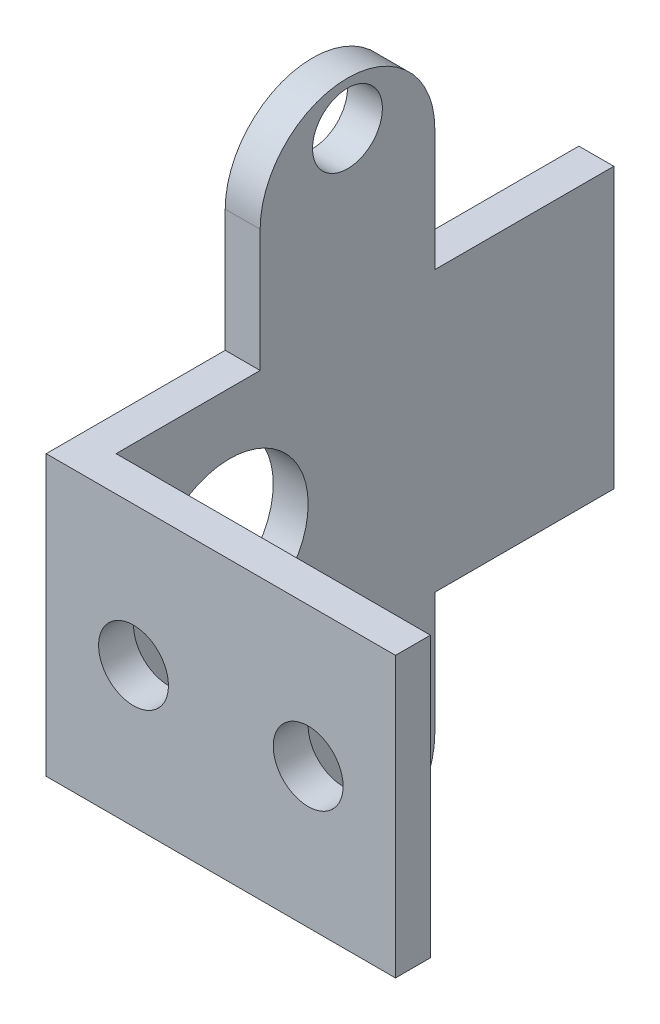
from build123d import *

# Parameters (mm, degrees)
BOSS_EXTRUDE1_DEPTH = 16
SKETCH4_R           = 2
CUT_EXTRUDE1_DEPTH  = 16
SKETCH6_W           = 2
SKETCH6_H           = 10
BOSS_EXTRUDE2_DEPTH = 12
CUT_EXTRUDE2_DEPTH  = 12
SKETCH8_R           = 2
CUT_EXTRUDE3_DEPTH  = 12
SKETCH9_R           = 4.5
CUT_EXTRUDE4_DEPTH  = 12


with BuildPart() as part:
    # Sketch1 → Boss-Extrude1 (new body)
    with BuildSketch(Plane(origin=(0, 0, 0), x_dir=(1, 0, 0), z_dir=(0, 1, 0))):
        Polygon((-17.922680412, 12.524914089), (-17.922680412, -17.975085911), (2.077319588, -17.975085911), (2.077319588, -15.975085911), (-15.922680412, -15.975085911), (-15.922680412, 12.524914089), align=None)
    extrude(amount=BOSS_EXTRUDE1_DEPTH)

    # Sketch4 → Cut-Extrude1 (cut)
    with BuildSketch(Plane.XY.offset(17.975085911)):
        with Locations((-12.922680412, 8)):
            Circle(SKETCH4_R)
        with Locations((-2.922680412, 8)):
            Circle(SKETCH4_R)
    extrude(amount=-CUT_EXTRUDE1_DEPTH, mode=Mode.SUBTRACT)

    # Sketch6 → Boss-Extrude2 (add)
    with BuildSketch(Plane.XZ):
        with Locations((-16.922680412, 2.725085911)):
            Rectangle(SKETCH6_W, SKETCH6_H)
    boss_extrude2 = extrude(amount=BOSS_EXTRUDE2_DEPTH)

    # Sketch7 → Cut-Extrude2 (cut)
    with BuildSketch(Plane(origin=(-15.922680412, 0, 0), x_dir=(0, 0, -1), z_dir=(1, 0, 0))):
        with BuildLine():
            Line((-11.171347401, -12.363043628), (4.929338565, -12.363043628))
            Line((4.929338565, -12.363043628), (4.929338565, -7))
            Line((4.929338565, -7), (2.274914089, -7))
            ThreePointArc((2.274914089, -7), (-2.725085911, -12), (-7.725085911, -7))
            Line((-7.725085911, -7), (-11.171347401, -7))
            Line((-11.171347401, -7), (-11.171347401, -12.363043628))
        make_face()
    cut_extrude2 = extrude(amount=-CUT_EXTRUDE2_DEPTH, mode=Mode.SUBTRACT)

    # Sketch8 → Cut-Extrude3 (cut)
    with BuildSketch(Plane(origin=(-15.922680412, 0, 0), x_dir=(0, 0, -1), z_dir=(1, 0, 0))):
        with Locations((-2.725085911, -9.5)):
            Circle(SKETCH8_R)
    cut_extrude3 = extrude(amount=-CUT_EXTRUDE3_DEPTH, mode=Mode.SUBTRACT)

    # Mirror1: Boss-Extrude2, Cut-Extrude2, Cut-Extrude3 across plane
    add(boss_extrude2.mirror(Plane(origin=(0, 8, 0), x_dir=(0, 0, 1), z_dir=(0, -1, 0))))
    add(cut_extrude2.mirror(Plane(origin=(0, 8, 0), x_dir=(0, 0, 1), z_dir=(0, -1, 0))), mode=Mode.SUBTRACT)
    add(cut_extrude3.mirror(Plane(origin=(0, 8, 0), x_dir=(0, 0, 1), z_dir=(0, -1, 0))), mode=Mode.SUBTRACT)

    # Sketch9 → Cut-Extrude4 (cut)
    with BuildSketch(Plane(origin=(-15.922680412, 0, 0), x_dir=(0, 0, -1), z_dir=(1, 0, 0))):
        with Locations((-9.475085911, 8)):
            Circle(SKETCH9_R)
    extrude(amount=-CUT_EXTRUDE4_DEPTH, mode=Mode.SUBTRACT)


solid = part.part
